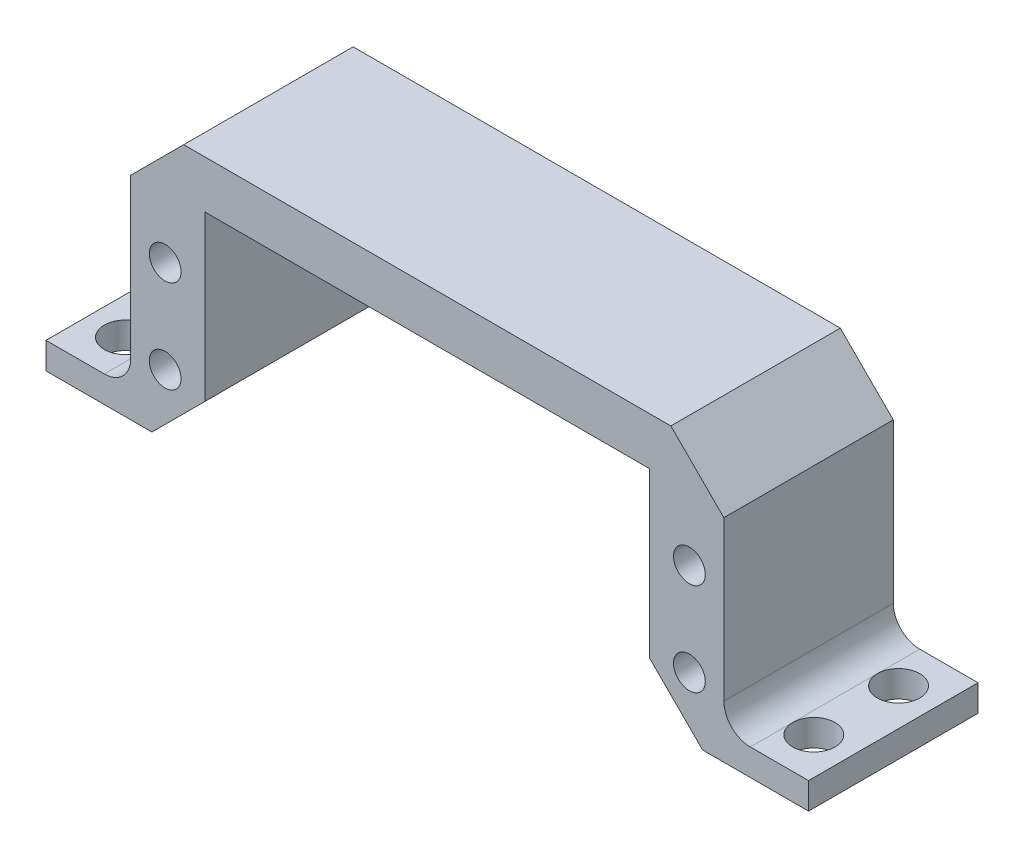
from build123d import *

# Parameters (mm, degrees)
BOSS_EXTRUDE1_DEPTH = 8
CHAMFER5_SIZE       = 5
FILLET1_R           = 2.5
SKETCH2_R           = 1.5
CUT_EXTRUDE1_DEPTH  = 47.658332589
SKETCH3_R           = 2
CUT_EXTRUDE2_DEPTH  = 44.200115741


with BuildPart() as part:
    # Sketch1 → Boss-Extrude1 (new, symmetric)
    with BuildSketch(Plane.XY):
        Polygon((-36, 0), (-21, 0), (-21, 20.5), (21, 20.5), (21, 0), (36, 0), (36, 2.5), (28, 2.5), (28, 25), (-28, 25), (-28, 2.5), (-36, 2.5), align=None)
    extrude(amount=BOSS_EXTRUDE1_DEPTH, both=True)

    # Chamfer5
    chamfer5_edges = [part.edges().sort_by_distance(p)[0] for p in [
        (-28, 25, 0),
        (28, 25, 0),
        (21, 0, 0),
        (-21, 0, 0),
    ]]
    chamfer(chamfer5_edges, length=CHAMFER5_SIZE)

    # Fillet1
    fillet1_edges = [part.edges().sort_by_distance(p)[0] for p in [
        (-28, 2.5, 0),
        (28, 2.5, 0),
    ]]
    fillet(fillet1_edges, radius=FILLET1_R)

    # Sketch2 → Cut-Extrude1 (cut, through all)
    with BuildSketch(Plane.XY.offset(8)):
        with Locations((-24.75, 14.475)):
            Circle(SKETCH2_R)
        with Locations((-24.75, 5.725)):
            Circle(SKETCH2_R)
        with Locations((24.75, 14.475)):
            Circle(SKETCH2_R)
        with Locations((24.75, 5.725)):
            Circle(SKETCH2_R)
    extrude(amount=-CUT_EXTRUDE1_DEPTH, mode=Mode.SUBTRACT)

    # Sketch3 → Cut-Extrude2 (cut, through all)
    with BuildSketch(Plane(origin=(0, 2.5, 0), x_dir=(1, 0, 0), z_dir=(0, 1, 0))):
        with Locations(Location((32.5, 4, 0), (0, 0, 270))):
            Circle(SKETCH3_R)
        with Locations(Location((32.5, -4, 0), (0, 0, 270))):
            Circle(SKETCH3_R)
        with Locations(Location((-32.5, 4, 0), (0, 0, 270))):
            Circle(SKETCH3_R)
        with Locations(Location((-32.5, -4, 0), (0, 0, 270))):
            Circle(SKETCH3_R)
    extrude(amount=-CUT_EXTRUDE2_DEPTH, mode=Mode.SUBTRACT)


solid = part.part
